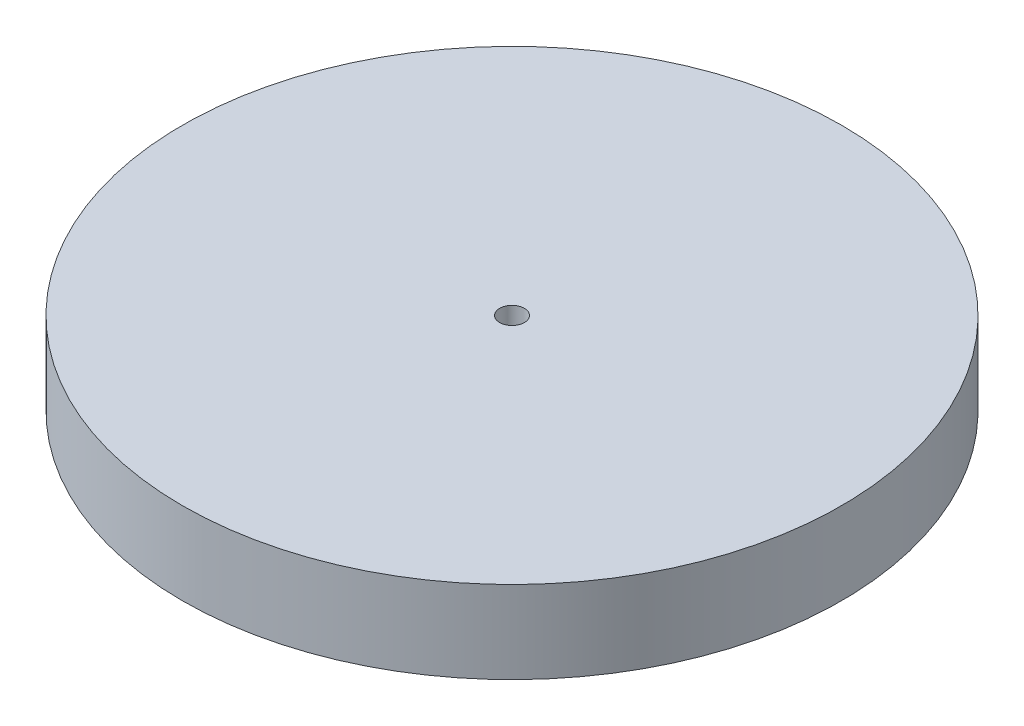
from build123d import *

# Parameters (mm, degrees)
SKETCH_1_R      = 40
SKETCH_1_R_2    = 1.5
EXTRUDE_1_DEPTH = 10


with BuildPart() as part:
    # 草圖1 → 填料-伸長1 (new body)
    with BuildSketch(Plane(origin=(0, 0, 0), x_dir=(1, 0, 0), z_dir=(0, 1, 0))):
        with Locations(Location((0, 0, 0), (0, 0, 270))):
            Circle(SKETCH_1_R)
        with Locations(Location((0, 0, 0), (0, 0, 270))):
            Circle(SKETCH_1_R_2, mode=Mode.SUBTRACT)
    extrude(amount=EXTRUDE_1_DEPTH)


solid = part.part
